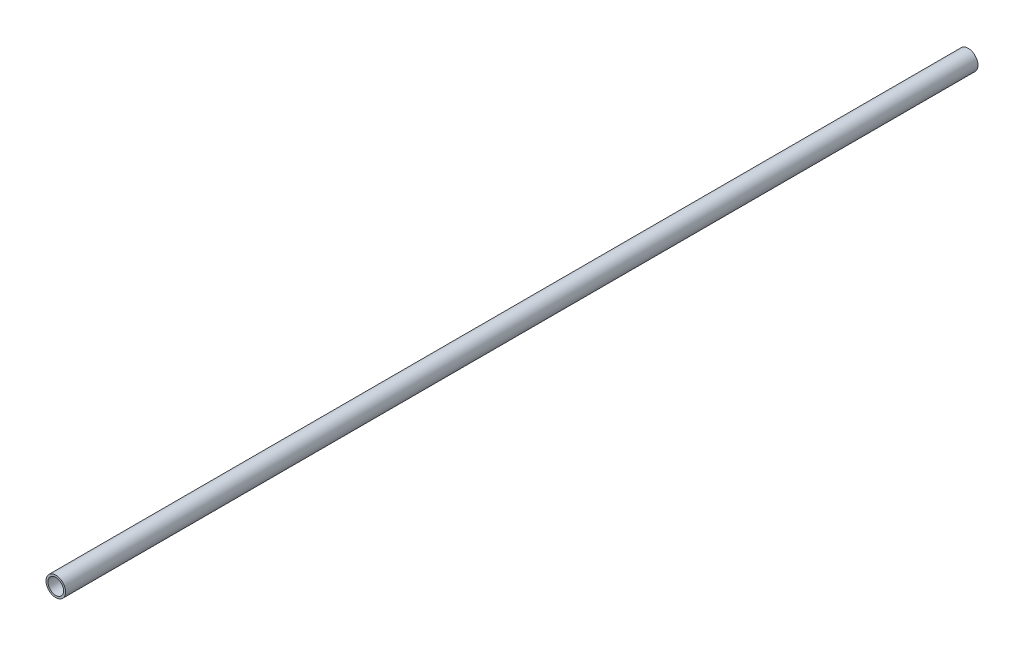
from build123d import *

# Parameters (mm, degrees)
SKETCH1_R           = 15
BOSS_EXTRUDE1_DEPTH = 1400
SKETCH2_R           = 12
CUT_EXTRUDE1_DEPTH  = 1400


with BuildPart() as part:
    # Sketch1 → Boss-Extrude1 (new body)
    with BuildSketch(Plane.XY):
        Circle(SKETCH1_R)
    extrude(amount=BOSS_EXTRUDE1_DEPTH)

    # Sketch2 → Cut-Extrude1 (cut)
    with BuildSketch(Plane.XY):
        Circle(SKETCH2_R)
    extrude(amount=CUT_EXTRUDE1_DEPTH, mode=Mode.SUBTRACT)


solid = part.part
